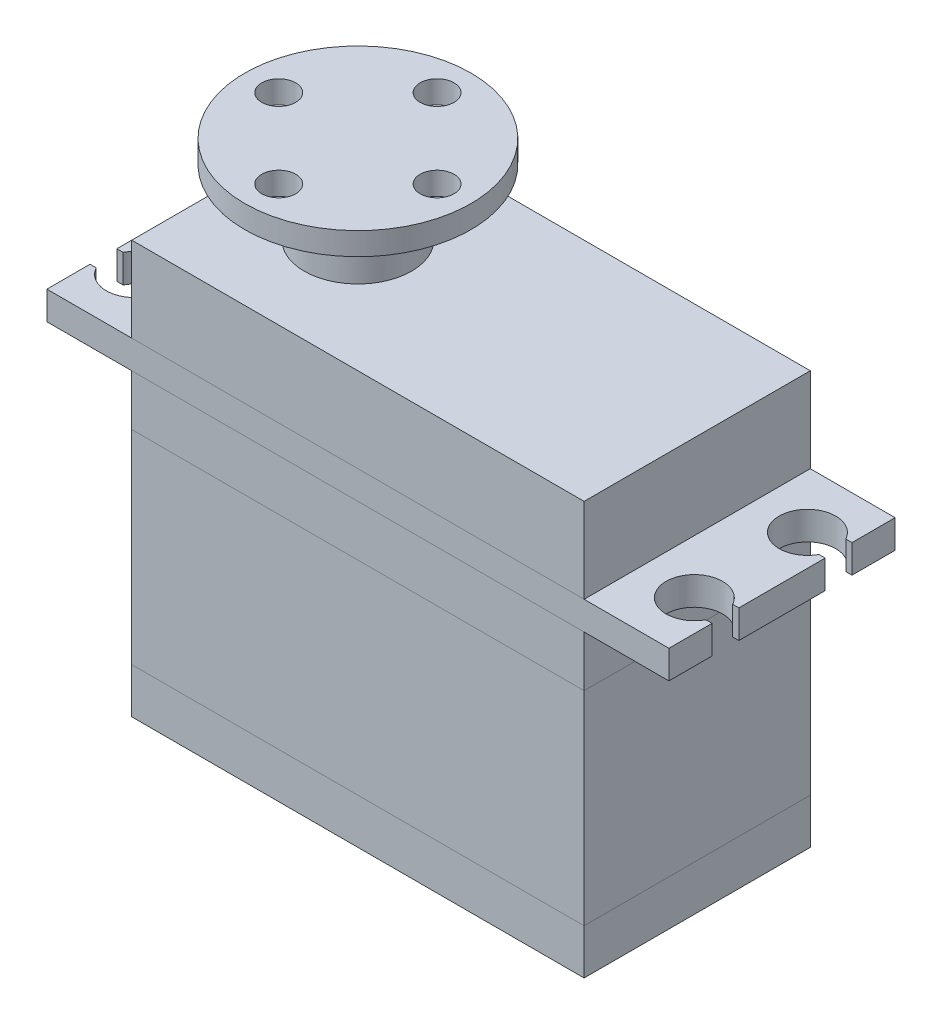
from build123d import *

# Parameters (mm, degrees)
SKETCH_1_W          = 40
SKETCH_1_H          = 20
EXTRUDE_1_DEPTH     = 4
SKETCH_2_W          = 40
SKETCH_2_H          = 20
EXTRUDE_2_DEPTH     = 18
SKETCH_3_W          = 40
SKETCH_3_H          = 20
EXTRUDE_3_DEPTH     = 4.5
SKETCH_4_W          = 55
SKETCH_4_H          = 20
EXTRUDE_4_DEPTH     = 2.5
SKETCH_5_W          = 40
SKETCH_5_H          = 20
EXTRUDE_5_DEPTH     = 7.5
CUT_EXTRUDE_2_DEPTH = 47.781406563
SKETCH_7_R          = 4.75
EXTRUDE_6_DEPTH     = 5.8
SKETCH_9_R          = 10
EXTRUDE_7_DEPTH     = 2
SKETCH_10_R         = 2.75
EXTRUDE_8_DEPTH     = 2.5
SKETCH_11_R         = 1.5
CUT_EXTRUDE_3_DEPTH = 2.8
CUT_EXTRUDE_4_DEPTH = 1
SKETCH_13_R         = 2.75
CUT_EXTRUDE_5_DEPTH = 2.5


with BuildPart() as part:
    # 草图1 → 凸台-拉伸1 (new body)
    with BuildSketch(Plane(origin=(0, 0, 0), x_dir=(1, 0, 0), z_dir=(0, 1, 0))):
        Rectangle(SKETCH_1_W, SKETCH_1_H)
    extrude(amount=EXTRUDE_1_DEPTH)


with BuildPart() as body_2:
    # 草图2 → 凸台-拉伸2 (new body)
    with BuildSketch(Plane(origin=(0, 4, 0), x_dir=(1, 0, 0), z_dir=(0, 1, 0))):
        Rectangle(SKETCH_2_W, SKETCH_2_H)
    extrude(amount=EXTRUDE_2_DEPTH)


with BuildPart() as body_3:
    # 草图3 → 凸台-拉伸3 (new body)
    with BuildSketch(Plane(origin=(0, 22, 0), x_dir=(1, 0, 0), z_dir=(0, 1, 0))):
        Rectangle(SKETCH_3_W, SKETCH_3_H)
    extrude(amount=EXTRUDE_3_DEPTH)


with BuildPart() as body_4:
    # 草图4 → 凸台-拉伸4 (new body)
    with BuildSketch(Plane(origin=(0, 26.5, 0), x_dir=(1, 0, 0), z_dir=(0, 1, 0))):
        Rectangle(SKETCH_4_W, SKETCH_4_H)
    extrude(amount=EXTRUDE_4_DEPTH)

    # 草图6 → 切除-拉伸2 (cut, through all)
    with BuildSketch(Plane(origin=(0, 36.5, 0), x_dir=(1, 0, 0), z_dir=(0, 1, 0))):
        with BuildLine():
            ThreePointArc((-22.25, 5), (-24.138968197, 7.424178239), (-26.951312109, 6.185))
            Line((-26.951312109, 6.185), (-24.064754398, 6.185))
            Line((-24.064754398, 6.185), (-24.064754398, 3.815))
            Line((-24.064754398, 3.815), (-26.951312109, 3.815))
            ThreePointArc((-26.951312109, 3.815), (-24.138968197, 2.575821761), (-22.25, 5))
        make_face()
        with BuildLine():
            Line((-24.064754398, 6.185), (-26.951312109, 6.185))
            ThreePointArc((-26.951312109, 6.185), (-27.25, 5), (-26.951312109, 3.815))
            Line((-26.951312109, 3.815), (-24.064754398, 3.815))
            Line((-24.064754398, 3.815), (-24.064754398, 6.185))
        make_face()
        with BuildLine():
            Line((-26.951312109, 6.185), (-28.064754398, 6.185))
            Line((-28.064754398, 6.185), (-28.064754398, 3.815))
            Line((-28.064754398, 3.815), (-26.951312109, 3.815))
            ThreePointArc((-26.951312109, 3.815), (-27.25, 5), (-26.951312109, 6.185))
        make_face()
        with BuildLine():
            ThreePointArc((-22.25, -5), (-24.138968197, -2.575821761), (-26.951312109, -3.815))
            Line((-26.951312109, -3.815), (-24.064754398, -3.815))
            Line((-24.064754398, -3.815), (-24.064754398, -6.185))
            Line((-24.064754398, -6.185), (-26.951312109, -6.185))
            ThreePointArc((-26.951312109, -6.185), (-24.138968197, -7.424178239), (-22.25, -5))
        make_face()
        with BuildLine():
            Line((-24.064754398, -3.815), (-26.951312109, -3.815))
            ThreePointArc((-26.951312109, -3.815), (-27.25, -5), (-26.951312109, -6.185))
            Line((-26.951312109, -6.185), (-24.064754398, -6.185))
            Line((-24.064754398, -6.185), (-24.064754398, -3.815))
        make_face()
        with BuildLine():
            Line((-26.951312109, -3.815), (-28.064754398, -3.815))
            Line((-28.064754398, -3.815), (-28.064754398, -6.185))
            Line((-28.064754398, -6.185), (-26.951312109, -6.185))
            ThreePointArc((-26.951312109, -6.185), (-27.25, -5), (-26.951312109, -3.815))
        make_face()
        with BuildLine():
            ThreePointArc((26.951312109, 6.185), (22.25, 5), (26.951312109, 3.815))
            Line((26.951312109, 3.815), (24.064754398, 3.815))
            Line((24.064754398, 3.815), (24.064754398, 6.185))
            Line((24.064754398, 6.185), (26.951312109, 6.185))
        make_face()
        with BuildLine():
            Line((24.064754398, 3.815), (26.951312109, 3.815))
            ThreePointArc((26.951312109, 3.815), (27.174178239, 4.388968197), (27.25, 5))
            ThreePointArc((27.25, 5), (27.174178239, 5.611031803), (26.951312109, 6.185))
            Line((26.951312109, 6.185), (24.064754398, 6.185))
            Line((24.064754398, 6.185), (24.064754398, 3.815))
        make_face()
        with BuildLine():
            Line((26.951312109, 3.815), (28.064754398, 3.815))
            Line((28.064754398, 3.815), (28.064754398, 6.185))
            Line((28.064754398, 6.185), (26.951312109, 6.185))
            ThreePointArc((26.951312109, 6.185), (27.174178239, 5.611031803), (27.25, 5))
            ThreePointArc((27.25, 5), (27.174178239, 4.388968197), (26.951312109, 3.815))
        make_face()
        with BuildLine():
            ThreePointArc((26.951312109, -3.815), (22.25, -5), (26.951312109, -6.185))
            Line((26.951312109, -6.185), (24.064754398, -6.185))
            Line((24.064754398, -6.185), (24.064754398, -3.815))
            Line((24.064754398, -3.815), (26.951312109, -3.815))
        make_face()
        with BuildLine():
            Line((24.064754398, -6.185), (26.951312109, -6.185))
            ThreePointArc((26.951312109, -6.185), (27.174178239, -5.611031803), (27.25, -5))
            ThreePointArc((27.25, -5), (27.174178239, -4.388968197), (26.951312109, -3.815))
            Line((26.951312109, -3.815), (24.064754398, -3.815))
            Line((24.064754398, -3.815), (24.064754398, -6.185))
        make_face()
        with BuildLine():
            Line((26.951312109, -6.185), (28.064754398, -6.185))
            Line((28.064754398, -6.185), (28.064754398, -3.815))
            Line((28.064754398, -3.815), (26.951312109, -3.815))
            ThreePointArc((26.951312109, -3.815), (27.174178239, -4.388968197), (27.25, -5))
            ThreePointArc((27.25, -5), (27.174178239, -5.611031803), (26.951312109, -6.185))
        make_face()
    extrude(amount=-CUT_EXTRUDE_2_DEPTH, mode=Mode.SUBTRACT)


with BuildPart() as body_5:
    # 草图5 → 凸台-拉伸5 (new body)
    with BuildSketch(Plane(origin=(0, 29, 0), x_dir=(1, 0, 0), z_dir=(0, 1, 0))):
        Rectangle(SKETCH_5_W, SKETCH_5_H)
    extrude(amount=EXTRUDE_5_DEPTH)

    # 草图7 → 凸台-拉伸6 (add)
    with BuildSketch(Plane(origin=(0, 36.5, 0), x_dir=(1, 0, 0), z_dir=(0, 1, 0))):
        with Locations(Location((-10, 0, 0), (0, 0, 270))):
            Circle(SKETCH_7_R)
    extrude(amount=EXTRUDE_6_DEPTH)

    # 草图9 → 凸台-拉伸7 (add)
    with BuildSketch(Plane(origin=(0, 42.3, 0), x_dir=(1, 0, 0), z_dir=(0, 1, 0))):
        with Locations(Location((-10, 0, 0), (0, 0, 270))):
            Circle(SKETCH_9_R)
    extrude(amount=EXTRUDE_7_DEPTH)

    # 草图10 → 凸台-拉伸8 (add)
    with BuildSketch(Plane(origin=(0, 44.3, 0), x_dir=(1, 0, 0), z_dir=(0, 1, 0))):
        with Locations(Location((-10, 0, 0), (0, 0, 270))):
            Circle(SKETCH_10_R)
    extrude(amount=EXTRUDE_8_DEPTH)

    # 草图11 → 切除-拉伸3 (cut)
    with BuildSketch(Plane(origin=(0, 44.3, 0), x_dir=(1, 0, 0), z_dir=(0, 1, 0))):
        with Locations(Location((-10, 7, 0), (0, 0, 270))):
            Circle(SKETCH_11_R)
        with Locations(Location((-17, 0, 0), (0, 0, 270))):
            Circle(SKETCH_11_R)
        with Locations(Location((-10, -7, 0), (0, 0, 270))):
            Circle(SKETCH_11_R)
        with Locations(Location((-3, 0, 0), (0, 0, 270))):
            Circle(SKETCH_11_R)
    extrude(amount=-CUT_EXTRUDE_3_DEPTH, mode=Mode.SUBTRACT)

    # 草图12 → 切除-拉伸4 (cut)
    with BuildSketch(Plane(origin=(0, 46.8, 0), x_dir=(1, 0, 0), z_dir=(0, 1, 0))):
        Polygon((-9.251607711, -1.234197033), (-8.556957872, 0.031028218), (-9.305350161, 1.26522525), (-10.748392289, 1.234197033), (-11.443042128, -0.031028218), (-10.694649839, -1.26522525), align=None)
    extrude(amount=-CUT_EXTRUDE_4_DEPTH, mode=Mode.SUBTRACT)

    # 草图13 → 切除-拉伸5 (cut)
    with BuildSketch(Plane(origin=(0, 46.8, 0), x_dir=(1, 0, 0), z_dir=(0, 1, 0))):
        with Locations((-10, 0)):
            Circle(SKETCH_13_R)
    extrude(amount=-CUT_EXTRUDE_5_DEPTH, mode=Mode.SUBTRACT)


solid = Compound([part.part, body_2.part, body_3.part, body_4.part, body_5.part])
